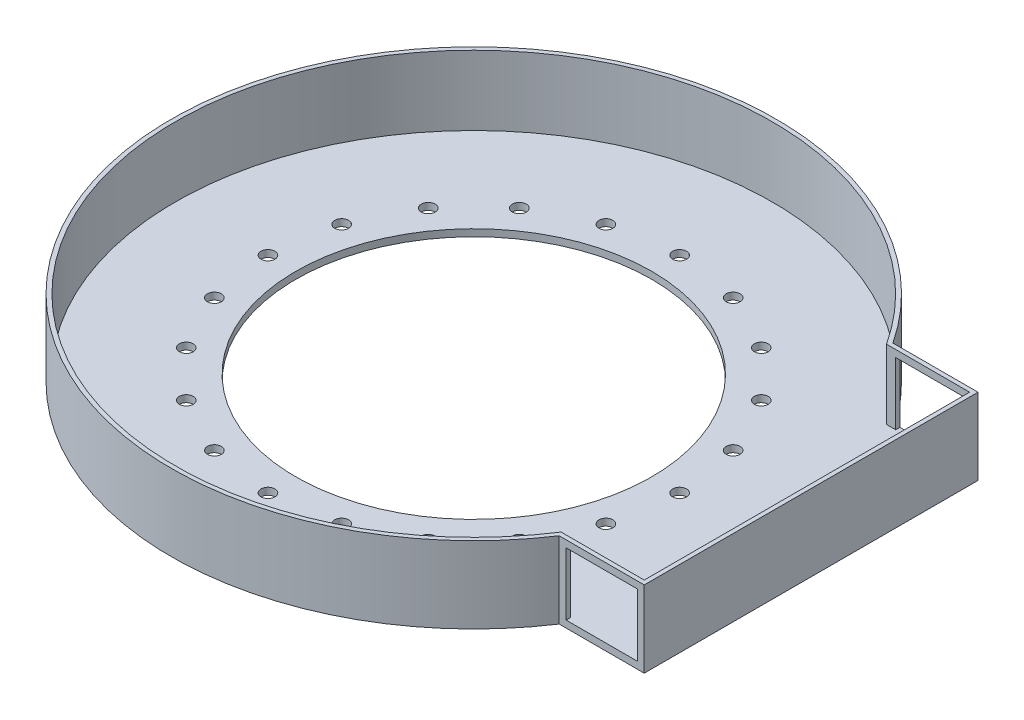
from build123d import *

# Parameters (mm, degrees)
ESQUISSE1_W                  = 80
ESQUISSE1_H                  = 10
ESQUISSE3_R                  = 10
ENL_V_MAT_EXTRU_1_DEPTH      = 476.280969533
R_P_TITION_CIRCULAIRE1_COUNT = 20
BOSS_EXTRU_1_START           = -10
BOSS_EXTRU_1_DEPTH           = 10
BOSS_EXTRU_2_START           = -10
BOSS_EXTRU_2_DEPTH           = 10
BOSS_EXTRU_3_START           = 100
BOSS_EXTRU_3_DEPTH           = 100
ESQUISSE8_W                  = 102.349416634
ESQUISSE8_H                  = 90
ENL_V_MAT_EXTRU_2_DEPTH      = 839.508501837


with BuildPart() as part:
    # Esquisse1 → Révolution1 (revolve)
    with BuildSketch(Plane.XY, mode=Mode.PRIVATE) as r_volution1_sk:
        with Locations((296, 5)):
            Rectangle(ESQUISSE1_W, ESQUISSE1_H)
    revolve(r_volution1_sk.sketch.rotate(Axis((0, 0, 0), (0, 1, 0)), 90), axis=Axis((0, 0, 0), (0, 1, 0)))

    # Esquisse3 → Enlèv. mat.-Extru.1 (cut, through all)
    with BuildSketch(Plane(origin=(0, 10, 0), x_dir=(1, 0, 0), z_dir=(0, 1, 0))):
        with Locations(Location((296, 0, 0), (0, 0, 270))):
            Circle(ESQUISSE3_R)
    enl_v_mat_extru_1 = extrude(amount=-ENL_V_MAT_EXTRU_1_DEPTH, mode=Mode.SUBTRACT)

    # Répétition circulaire1: Enlèv. mat.-Extru.1 ×20 about axis
    r_p_tition_circulaire1_axis = Axis((0, 0, 0), (0, 1, 0))
    for i in range(1, R_P_TITION_CIRCULAIRE1_COUNT):
        add(enl_v_mat_extru_1.rotate(r_p_tition_circulaire1_axis, i * 360 / R_P_TITION_CIRCULAIRE1_COUNT), mode=Mode.SUBTRACT)

    # Esquisse4 → Boss.-Extru.1 (add)
    with BuildSketch(Plane.XZ.offset(BOSS_EXTRU_1_START)):
        with BuildLine():
            Line((485.151015307, -240), (485.151015307, 240))
            Line((485.151015307, 240), (235.151015307, 240))
            ThreePointArc((235.151015307, 240), (336, 0), (235.151015307, -240))
            Line((235.151015307, -240), (485.151015307, -240))
        make_face()
    extrude(amount=BOSS_EXTRU_1_DEPTH)

    # Esquisse5 → Boss.-Extru.2 (add)
    with BuildSketch(Plane.XZ.offset(BOSS_EXTRU_2_START)):
        with BuildLine():
            Line((235.151015307, -240), (362.801598673, -240))
            ThreePointArc((362.801598673, -240), (-435, 0), (362.801598673, 240))
            Line((362.801598673, 240), (235.151015307, 240))
            ThreePointArc((235.151015307, 240), (-336, 0), (235.151015307, -240))
        make_face()
    extrude(amount=BOSS_EXTRU_2_DEPTH)

    # Esquisse6 → Boss.-Extru.3 (add)
    with BuildSketch(Plane(origin=(0, 10, 0), x_dir=(1, 0, 0), z_dir=(0, 1, 0)).offset(BOSS_EXTRU_3_START)):
        with BuildLine():
            Line((485.151015307, 240), (362.801598673, 240))
            ThreePointArc((362.801598673, 240), (-435, 0), (362.801598673, -240))
            Line((362.801598673, -240), (485.151015307, -240))
            Line((485.151015307, -240), (485.151015307, 240))
        make_face()
        with BuildLine():
            ThreePointArc((359.562233834, 234), (-429, 0), (359.562233834, -234))
            Line((359.562233834, -234), (479.151015307, -234))
            Line((479.151015307, -234), (479.151015307, 234))
            Line((479.151015307, 234), (359.562233834, 234))
        make_face(mode=Mode.SUBTRACT)
    extrude(amount=-BOSS_EXTRU_3_DEPTH)

    # Esquisse8 → Enlèv. mat.-Extru.2 (cut, through all)
    with BuildSketch(Plane.XY.offset(240)):
        with Locations((423.97630699, 55)):
            Rectangle(ESQUISSE8_W, ESQUISSE8_H)
    extrude(amount=-ENL_V_MAT_EXTRU_2_DEPTH, mode=Mode.SUBTRACT)


solid = part.part
